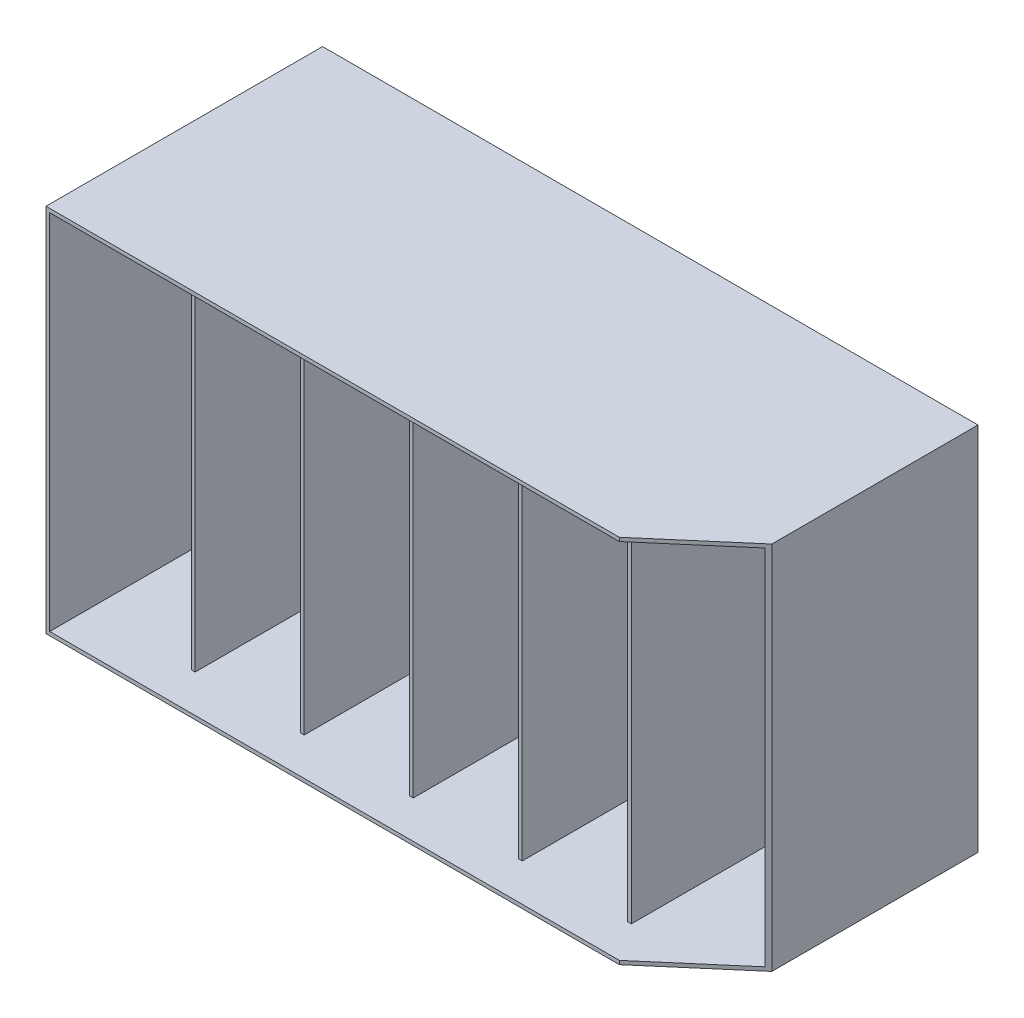
from build123d import *

# Parameters (mm, degrees)
SKETCH1_W           = 558.8
SKETCH1_H           = 315.575
BOSS_EXTRUDE1_DEPTH = 3.175
SKETCH2_W           = 558.8
SKETCH2_H           = 315.575
SKETCH2_W_2         = 88.644
SKETCH2_H_2         = 309.225
SKETCH2_W_3         = 89.789
SKETCH2_W_4         = 88.775
BOSS_EXTRUDE2_DEPTH = 200.6
SKETCH3_W           = 558.8
SKETCH3_H           = 315.575
BOSS_EXTRUDE3_DEPTH = 32
CUT_EXTRUDE1_DEPTH  = 483.951127186


with BuildPart() as part:
    # Sketch1 → Boss-Extrude1 (new body)
    with BuildSketch(Plane.XY):
        Rectangle(SKETCH1_W, SKETCH1_H)
    extrude(amount=BOSS_EXTRUDE1_DEPTH)

    # Sketch2 → Boss-Extrude2 (add)
    with BuildSketch(Plane.XY.offset(3.175)):
        Rectangle(SKETCH2_W, SKETCH2_H)
        with Locations((231.903, 0)):
            Rectangle(SKETCH2_W_2, SKETCH2_H_2, mode=Mode.SUBTRACT)
        with Locations((139.5115, 0)):
            Rectangle(SKETCH2_W_3, SKETCH2_H_2, mode=Mode.SUBTRACT)
        with Locations((46.5475, 0)):
            Rectangle(SKETCH2_W_3, SKETCH2_H_2, mode=Mode.SUBTRACT)
        with Locations((-46.4165, 0)):
            Rectangle(SKETCH2_W_3, SKETCH2_H_2, mode=Mode.SUBTRACT)
        with Locations((-139.3805, 0)):
            Rectangle(SKETCH2_W_3, SKETCH2_H_2, mode=Mode.SUBTRACT)
        with Locations((-231.8375, 0)):
            Rectangle(SKETCH2_W_4, SKETCH2_H_2, mode=Mode.SUBTRACT)
    extrude(amount=BOSS_EXTRUDE2_DEPTH)

    # Sketch3 → Boss-Extrude3 (add)
    with BuildSketch(Plane.XY.offset(203.775)):
        Rectangle(SKETCH3_W, SKETCH3_H)
        Polygon((187.581, 154.6125), (276.225, 154.6125), (276.225, -154.6125), (187.581, -154.6125), (184.406, -154.6125), (94.617, -154.6125), (91.442, -154.6125), (1.653, -154.6125), (-1.522, -154.6125), (-91.311, -154.6125), (-94.486, -154.6125), (-184.275, -154.6125), (-187.45, -154.6125), (-276.225, -154.6125), (-276.225, 154.6125), (-187.45, 154.6125), (-184.275, 154.6125), (-94.486, 154.6125), (-91.311, 154.6125), (-1.522, 154.6125), (1.653, 154.6125), (91.442, 154.6125), (94.617, 154.6125), (184.406, 154.6125), align=None, mode=Mode.SUBTRACT)
    extrude(amount=BOSS_EXTRUDE3_DEPTH)

    # Sketch4 → Cut-Extrude1 (cut, through all)
    with BuildSketch(Plane.XZ.offset(157.7875)):
        Polygon((279.4, 235.775), (209.4, 235.775), (279.4, 175.775), align=None)
    extrude(amount=-CUT_EXTRUDE1_DEPTH, mode=Mode.SUBTRACT)


solid = part.part
